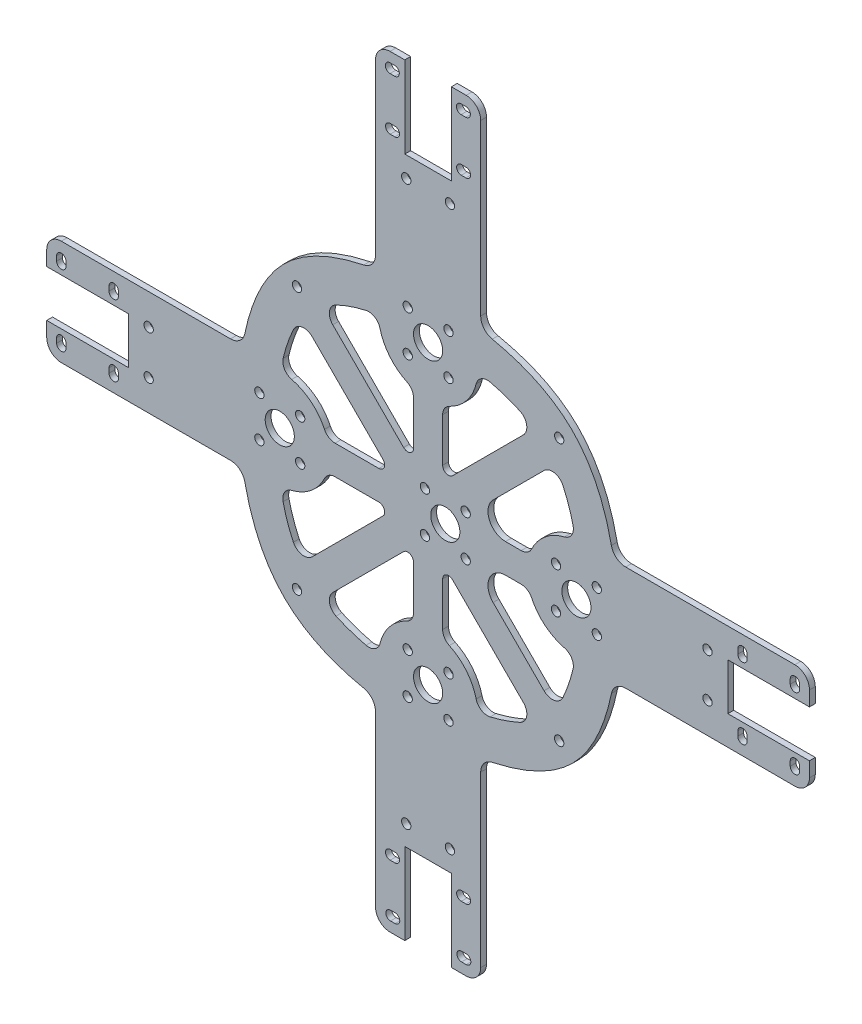
from build123d import *

# Parameters (mm, degrees)
SKETCH1_R           = 1.6
SKETCH1_R_2         = 1.599999999
SKETCH1_R_3         = 1.600000002
SKETCH1_R_4         = 1.600000003
BOSS_EXTRUDE1_DEPTH = 2
SKETCH5_R           = 5
CUT_EXTRUDE1_DEPTH  = 2
SKETCH7_R           = 1.6
CUT_EXTRUDE2_DEPTH  = 2
CUT_EXTRUDE9_DEPTH  = 2
SKETCH10_R          = 1.599999998
SKETCH10_R_2        = 1.6
CUT_EXTRUDE10_DEPTH = 2


with BuildPart() as part:
    # Sketch1 → Boss-Extrude1 (new body)
    with BuildSketch(Plane.XY.offset(157.173262417)):
        with BuildLine():
            Line((6.799091356, -38.814036397), (6.799091356, 19.286276854))
            ThreePointArc((6.799091356, 19.286276854), (5.670788043, 22.450129689), (2.795105451, 24.18606827))
            add(Edge.make_bspline(
                [(-38.04772835, 65.059119821), (-35.801922327, 54.275844913), (-27.373024283, 34.867662181), (-8.005693396, 26.381620483), (2.795105451, 24.18606827)],
                knots=[0.799368004, 0.799368004, 0.799368004, 0.799368004, 0.875, 0.95065347, 0.95065347, 0.95065347, 0.95065347], degree=3))
            ThreePointArc((-38.04772835, 65.059119821), (-39.788119726, 67.918917036), (-42.942694753, 69.039657262))
            Line((-42.942694753, 69.039657262), (-42.948724748, 69.039657262))
            Line((-42.948724748, 69.039657262), (-101.054602299, 69.039657262))
            ThreePointArc((-101.054602299, 69.039657262), (-104.590136205, 70.504123356), (-106.054602299, 74.039657262))
            Line((-106.054602299, 74.039657262), (-106.054602299, 79.097651827))
            Line((-106.054602299, 79.097651827), (-78.0546023, 79.097651827))
            Line((-78.0546023, 79.097651827), (-78.0546023, 95.09765186))
            Line((-78.0546023, 95.09765186), (-106.054602299, 95.09765186))
            Line((-106.054602299, 95.09765186), (-106.054602299, 100.155646442))
            ThreePointArc((-106.054602299, 100.155646442), (-104.590136206, 103.691180348), (-101.0546023, 105.155646442))
            Line((-101.0546023, 105.155646442), (-42.953397481, 105.155646442))
            ThreePointArc((-42.953397481, 105.155646442), (-39.798044895, 106.2770191), (-38.058022756, 109.138146417))
            add(Edge.make_bspline(
                [(2.816283675, 150.012028913), (-7.973865697, 147.770011851), (-27.384909119, 139.342710765), (-35.815468738, 119.927475159), (-38.058022756, 109.138146417)],
                knots=[0.549351375, 0.549351375, 0.549351375, 0.549351375, 0.625, 0.700642098, 0.700642098, 0.700642098, 0.700642098], degree=3))
            ThreePointArc((2.816283675, 150.012028913), (5.677619532, 151.751993102), (6.799091359, 154.907467585))
            Line((6.799091359, 154.907467585), (6.799091359, 213.009340097))
            ThreePointArc((6.799091359, 213.009340097), (8.263557453, 216.544874003), (11.799091359, 218.009340097))
            Line((11.799091359, 218.009340097), (16.857085923, 218.009340097))
            Line((16.857085923, 218.009340097), (16.857085923, 190.009340098))
            Line((16.857085923, 190.009340098), (32.857085957, 190.009340098))
            Line((32.857085957, 190.009340098), (32.857085957, 218.009340096))
            Line((32.857085957, 218.009340096), (37.915080539, 218.009340096))
            ThreePointArc((37.915080539, 218.009340096), (41.450614444, 216.544874002), (42.915080538, 213.009340096))
            Line((42.915080538, 213.009340096), (42.915080538, 154.909026846))
            Line((42.915080538, 154.909026846), (42.915080538, 154.905301106))
            ThreePointArc((42.915080538, 154.905301106), (44.03648226, 151.749912795), (46.897670695, 150.009907638))
            add(Edge.make_bspline(
                [(87.768156571, 109.138684972), (85.526226985, 119.930968468), (77.10336574, 139.339428214), (57.688773215, 147.767192319), (46.897670695, 150.009907638)],
                knots=[0.299339526, 0.299339526, 0.299339526, 0.299339526, 0.375, 0.450650992, 0.450650992, 0.450650992, 0.450650992], degree=3))
            ThreePointArc((87.768156571, 109.138684972), (89.508077273, 106.277192658), (92.663643207, 105.155646426))
            Line((92.663643207, 105.155646426), (150.768774191, 105.155646426))
            ThreePointArc((150.768774191, 105.155646426), (154.304308097, 103.691180332), (155.768774191, 100.155646426))
            Line((155.768774191, 100.155646426), (155.768774191, 95.097651862))
            Line((155.768774191, 95.097651862), (127.768774193, 95.097651862))
            Line((127.768774193, 95.097651862), (127.768774193, 79.097651829))
            Line((127.768774193, 79.097651829), (155.768774192, 79.097651829))
            Line((155.768774192, 79.097651829), (155.768774192, 74.039657246))
            ThreePointArc((155.768774192, 74.039657246), (154.304308098, 70.504123341), (150.768774193, 69.039657247))
            Line((150.768774193, 69.039657247), (92.703908608, 69.125744836))
            ThreePointArc((92.703908608, 69.125744836), (89.540785873, 68.004087134), (87.799431714, 65.135089551))
            add(Edge.make_bspline(
                [(46.865804198, 24.180503464), (57.642070723, 26.49346369), (77.144065689, 34.842133488), (85.566398269, 54.300964474), (87.799431714, 65.135089551)],
                knots=[0.04934653, 0.04934653, 0.04934653, 0.04934653, 0.125, 0.200865999, 0.200865999, 0.200865999, 0.200865999], degree=3))
            ThreePointArc((46.865804198, 24.180503464), (44.02622584, 22.434580272), (42.915080536, 19.291841156))
            Line((42.915080536, 19.291841156), (42.915080536, -38.814036396))
            ThreePointArc((42.915080536, -38.814036396), (41.450614442, -42.349570302), (37.915080536, -43.814036396))
            Line((37.915080536, -43.814036396), (32.857085971, -43.814036396))
            Line((32.857085971, -43.814036396), (32.857085971, -15.814036397))
            Line((32.857085971, -15.814036397), (16.857085938, -15.814036397))
            Line((16.857085938, -15.814036397), (16.857085938, -43.814036396))
            Line((16.857085938, -43.814036396), (11.799091355, -43.814036396))
            ThreePointArc((11.799091355, -43.814036396), (8.26355745, -42.349570302), (6.799091356, -38.814036397))
        make_face()
        with Locations((17.357085946, -8.814036393)):
            Circle(SKETCH1_R, mode=Mode.SUBTRACT)
        with Locations((32.357085946, -8.814036393)):
            Circle(SKETCH1_R, mode=Mode.SUBTRACT)
        with Locations((-71.054602297, 94.597651852)):
            Circle(SKETCH1_R_2, mode=Mode.SUBTRACT)
        with Locations((-71.054602297, 79.597651852)):
            Circle(SKETCH1_R_2, mode=Mode.SUBTRACT)
        with Locations((32.357085949, 183.009340095)):
            Circle(SKETCH1_R_3, mode=Mode.SUBTRACT)
        with Locations((17.357085949, 183.009340095)):
            Circle(SKETCH1_R_3, mode=Mode.SUBTRACT)
        with Locations((120.768774191, 79.597651849)):
            Circle(SKETCH1_R_4, mode=Mode.SUBTRACT)
        with Locations((120.768774191, 94.597651849)):
            Circle(SKETCH1_R_4, mode=Mode.SUBTRACT)
        with BuildLine():
            Line((11.857085946, -19.214036396), (13.457085935, -19.214036396))
            ThreePointArc((13.457085935, -19.214036396), (15.057085934, -20.814036397), (13.457085933, -22.414036396))
            Line((13.457085933, -22.414036396), (11.857085946, -22.414036396))
            ThreePointArc((11.857085946, -22.414036396), (10.257085946, -20.814036396), (11.857085946, -19.214036396))
        make_face(mode=Mode.SUBTRACT)
        with BuildLine():
            Line((37.857085947, -19.214036397), (36.257085947, -19.214036397))
            ThreePointArc((36.257085947, -19.214036397), (34.657085947, -20.814036397), (36.257085947, -22.414036397))
            Line((36.257085947, -22.414036397), (37.857085947, -22.414036397))
            ThreePointArc((37.857085947, -22.414036397), (39.457085947, -20.814036397), (37.857085947, -19.214036397))
        make_face(mode=Mode.SUBTRACT)
        with BuildLine():
            Line((37.938189461, -40.414036397), (36.338189461, -40.414036397))
            ThreePointArc((36.338189461, -40.414036397), (34.738189461, -38.814036397), (36.338189461, -37.214036397))
            Line((36.338189461, -37.214036397), (37.938189461, -37.214036397))
            ThreePointArc((37.938189461, -37.214036397), (39.538189461, -38.814036397), (37.938189461, -40.414036397))
        make_face(mode=Mode.SUBTRACT)
        with BuildLine():
            Line((13.538189461, -40.414036397), (11.938189461, -40.414036397))
            ThreePointArc((11.938189461, -40.414036397), (10.338189461, -38.814036397), (11.938189461, -37.214036397))
            Line((11.938189461, -37.214036397), (13.538189461, -37.214036397))
            ThreePointArc((13.538189461, -37.214036397), (15.138189461, -38.814036397), (13.538189461, -40.414036397))
        make_face(mode=Mode.SUBTRACT)
        with BuildLine():
            Line((-81.454602299, 100.097651852), (-81.454602299, 98.497651863))
            ThreePointArc((-81.454602299, 98.497651863), (-83.0546023, 96.897651864), (-84.654602299, 98.497651865))
            Line((-84.654602299, 98.497651865), (-84.654602299, 100.097651852))
            ThreePointArc((-84.654602299, 100.097651852), (-83.054602299, 101.697651852), (-81.454602299, 100.097651852))
        make_face(mode=Mode.SUBTRACT)
        with BuildLine():
            Line((-81.4546023, 74.097651851), (-81.4546023, 75.697651851))
            ThreePointArc((-81.4546023, 75.697651851), (-83.0546023, 77.297651851), (-84.6546023, 75.697651851))
            Line((-84.6546023, 75.697651851), (-84.6546023, 74.097651851))
            ThreePointArc((-84.6546023, 74.097651851), (-83.0546023, 72.497651851), (-81.4546023, 74.097651851))
        make_face(mode=Mode.SUBTRACT)
        with BuildLine():
            Line((-102.6546023, 74.016548336), (-102.6546023, 75.616548336))
            ThreePointArc((-102.6546023, 75.616548336), (-101.0546023, 77.216548336), (-99.4546023, 75.616548336))
            Line((-99.4546023, 75.616548336), (-99.4546023, 74.016548336))
            ThreePointArc((-99.4546023, 74.016548336), (-101.0546023, 72.416548336), (-102.6546023, 74.016548336))
        make_face(mode=Mode.SUBTRACT)
        with BuildLine():
            Line((-102.6546023, 98.416548336), (-102.6546023, 100.016548336))
            ThreePointArc((-102.6546023, 100.016548336), (-101.0546023, 101.616548336), (-99.4546023, 100.016548336))
            Line((-99.4546023, 100.016548336), (-99.4546023, 98.416548336))
            ThreePointArc((-99.4546023, 98.416548336), (-101.0546023, 96.816548336), (-102.6546023, 98.416548336))
        make_face(mode=Mode.SUBTRACT)
        with BuildLine():
            Line((37.857085949, 193.409340097), (36.257085959, 193.409340097))
            ThreePointArc((36.257085959, 193.409340097), (34.65708596, 195.009340098), (36.257085961, 196.609340097))
            Line((36.257085961, 196.609340097), (37.857085949, 196.609340097))
            ThreePointArc((37.857085949, 196.609340097), (39.457085949, 195.009340097), (37.857085949, 193.409340097))
        make_face(mode=Mode.SUBTRACT)
        with BuildLine():
            Line((11.857085947, 193.409340098), (13.457085947, 193.409340098))
            ThreePointArc((13.457085947, 193.409340098), (15.057085947, 195.009340098), (13.457085947, 196.609340098))
            Line((13.457085947, 196.609340098), (11.857085947, 196.609340098))
            ThreePointArc((11.857085947, 196.609340098), (10.257085947, 195.009340098), (11.857085947, 193.409340098))
        make_face(mode=Mode.SUBTRACT)
        with BuildLine():
            Line((11.775982433, 214.609340098), (13.375982433, 214.609340098))
            ThreePointArc((13.375982433, 214.609340098), (14.975982433, 213.009340098), (13.375982433, 211.409340098))
            Line((13.375982433, 211.409340098), (11.775982433, 211.409340098))
            ThreePointArc((11.775982433, 211.409340098), (10.175982433, 213.009340098), (11.775982433, 214.609340098))
        make_face(mode=Mode.SUBTRACT)
        with BuildLine():
            Line((36.175982433, 214.609340098), (37.775982433, 214.609340098))
            ThreePointArc((37.775982433, 214.609340098), (39.375982433, 213.009340098), (37.775982433, 211.409340098))
            Line((37.775982433, 211.409340098), (36.175982433, 211.409340098))
            ThreePointArc((36.175982433, 211.409340098), (34.575982433, 213.009340098), (36.175982433, 214.609340098))
        make_face(mode=Mode.SUBTRACT)
        with BuildLine():
            Line((131.168774193, 74.097651849), (131.168774193, 75.697651839))
            ThreePointArc((131.168774193, 75.697651839), (132.768774195, 77.297651838), (134.368774193, 75.697651837))
            Line((134.368774193, 75.697651837), (134.368774193, 74.097651849))
            ThreePointArc((134.368774193, 74.097651849), (132.768774193, 72.497651849), (131.168774193, 74.097651849))
        make_face(mode=Mode.SUBTRACT)
        with BuildLine():
            Line((131.168774195, 100.097651851), (131.168774195, 98.497651851))
            ThreePointArc((131.168774195, 98.497651851), (132.768774195, 96.897651851), (134.368774195, 98.497651851))
            Line((134.368774195, 98.497651851), (134.368774195, 100.097651851))
            ThreePointArc((134.368774195, 100.097651851), (132.768774195, 101.697651851), (131.168774195, 100.097651851))
        make_face(mode=Mode.SUBTRACT)
        with BuildLine():
            Line((152.368774195, 100.178755365), (152.368774195, 98.578755365))
            ThreePointArc((152.368774195, 98.578755365), (150.768774195, 96.978755365), (149.168774195, 98.578755365))
            Line((149.168774195, 98.578755365), (149.168774195, 100.178755365))
            ThreePointArc((149.168774195, 100.178755365), (150.768774195, 101.778755365), (152.368774195, 100.178755365))
        make_face(mode=Mode.SUBTRACT)
        with BuildLine():
            Line((152.368774195, 75.778755365), (152.368774195, 74.178755365))
            ThreePointArc((152.368774195, 74.178755365), (150.768774195, 72.578755365), (149.168774195, 74.178755365))
            Line((149.168774195, 74.178755365), (149.168774195, 75.778755365))
            ThreePointArc((149.168774195, 75.778755365), (150.768774195, 77.378755365), (152.368774195, 75.778755365))
        make_face(mode=Mode.SUBTRACT)
    extrude(amount=BOSS_EXTRUDE1_DEPTH)

    # Sketch5 → Cut-Extrude1 (cut)
    with BuildSketch(Plane.XY.offset(159.173262417)):
        with Locations((30.768774191, 87.097651852)):
            Circle(SKETCH5_R)
        with Locations((75.768774191, 87.097651852)):
            Circle(SKETCH5_R)
        with Locations((-26.0546023, 87.097651852)):
            Circle(SKETCH5_R)
        with Locations((24.857085946, 36.185963607)):
            Circle(SKETCH5_R)
        with Locations((24.857085946, 138.009340097)):
            Circle(SKETCH5_R)
    extrude(amount=-CUT_EXTRUDE1_DEPTH, mode=Mode.SUBTRACT)

    # Sketch7 → Cut-Extrude2 (cut)
    with BuildSketch(Plane.XY.offset(159.173262417)):
        with Locations((-20.142914054, 132.097651852)):
            Circle(SKETCH7_R)
        with Locations((69.857085946, 132.097651852)):
            Circle(SKETCH7_R)
        with Locations((-20.142914054, 42.097651852)):
            Circle(SKETCH7_R)
        with Locations((69.857085946, 42.097651852)):
            Circle(SKETCH7_R)
    extrude(amount=-CUT_EXTRUDE2_DEPTH, mode=Mode.SUBTRACT)

    # Sketch9 → Cut-Extrude9 (cut)
    with BuildSketch(Plane.XY.offset(159.173262417)):
        with BuildLine():
            Line((-7.869007222, 126.894812831), (16.442872381, 102.582933227))
            ThreePointArc((16.442872381, 102.582933227), (18.622452809, 102.149387725), (19.857085944, 103.99714679))
            Line((19.857085944, 103.99714679), (19.857085944, 119.035674139))
            ThreePointArc((19.857085944, 119.035674139), (19.237702963, 121.173764074), (17.571371659, 122.64970575))
            ThreePointArc((17.571371659, 122.64970575), (11.694515597, 127.250774127), (8.354859625, 133.925649809))
            ThreePointArc((8.354859625, 133.925649809), (6.554598547, 136.379852783), (3.548496184, 136.856718349))
            ThreePointArc((3.548496184, 136.856718349), (-1.701622597, 135.389204341), (-6.752512799, 133.338386761))
            ThreePointArc((-6.752512799, 133.338386761), (-8.981852492, 130.406154235), (-7.869007222, 126.894812831))
        make_face()
        with BuildLine():
            Line((-14.940075038, 119.823745023), (9.371804575, 95.511865409))
            ThreePointArc((9.371804575, 95.511865409), (9.805350078, 93.332284982), (7.957591013, 92.097651847))
            Line((7.957591013, 92.097651847), (-7.080936337, 92.097651847))
            ThreePointArc((-7.080936337, 92.097651847), (-9.219026273, 92.717034828), (-10.694967949, 94.383366134))
            ThreePointArc((-10.694967949, 94.383366134), (-15.296036327, 100.260222201), (-21.970912014, 103.599878175))
            ThreePointArc((-21.970912014, 103.599878175), (-24.425114988, 105.400139252), (-24.901980554, 108.406241615))
            ThreePointArc((-24.901980554, 108.406241615), (-23.390630893, 113.641388235), (-21.383648969, 118.707250599))
            ThreePointArc((-21.383648969, 118.707250599), (-18.451416443, 120.936590293), (-14.940075038, 119.823745023))
        make_face()
        with BuildLine():
            Line((19.857085945, 55.159629565), (19.857085945, 70.198156916))
            ThreePointArc((19.857085945, 70.198156916), (18.622452809, 72.045915981), (16.442872382, 71.612370478))
            Line((16.442872382, 71.612370478), (-7.869007227, 47.30049087))
            ThreePointArc((-7.869007227, 47.30049087), (-8.981852496, 43.789149465), (-6.752512803, 40.856916939))
            ThreePointArc((-6.752512803, 40.856916939), (-1.686650438, 38.849935015), (3.548496184, 37.338585353))
            ThreePointArc((3.548496184, 37.338585353), (6.554598546, 37.81545092), (8.354859623, 40.269653894))
            ThreePointArc((8.354859623, 40.269653894), (11.694515596, 46.944529577), (17.571371659, 51.545597954))
            ThreePointArc((17.571371659, 51.545597954), (19.237702964, 53.02153963), (19.857085945, 55.159629565))
        make_face()
        with BuildLine():
            Line((29.857085944, 119.035674136), (29.857085944, 103.997146778))
            ThreePointArc((29.857085944, 103.997146778), (31.091719079, 102.149387713), (33.271299507, 102.582933216))
            Line((33.271299507, 102.582933216), (57.583179124, 126.894812833))
            ThreePointArc((57.583179124, 126.894812833), (58.696024393, 130.406154237), (56.4666847, 133.338386763))
            ThreePointArc((56.4666847, 133.338386763), (51.400822333, 135.345368689), (46.165675709, 136.856718352))
            ThreePointArc((46.165675709, 136.856718352), (43.159573346, 136.379852785), (41.359312269, 133.925649811))
            ThreePointArc((41.359312269, 133.925649811), (38.019656296, 127.250774126), (32.14280023, 122.649705748))
            ThreePointArc((32.14280023, 122.649705748), (30.476468925, 121.173764072), (29.857085944, 119.035674136))
        make_face()
        with BuildLine():
            Line((-14.940075033, 54.371558676), (9.371804581, 78.68343829))
            ThreePointArc((9.371804581, 78.68343829), (9.805350084, 80.863018717), (7.957591019, 82.097651853))
            Line((7.957591019, 82.097651853), (-7.08093634, 82.097651853))
            ThreePointArc((-7.08093634, 82.097651853), (-9.219026275, 81.478268872), (-10.694967951, 79.811937567))
            ThreePointArc((-10.694967951, 79.811937567), (-15.296036328, 73.935081503), (-21.970912012, 70.595425531))
            ThreePointArc((-21.970912012, 70.595425531), (-24.425114986, 68.795164453), (-24.901980552, 65.789062091))
            ThreePointArc((-24.901980552, 65.789062091), (-23.434466545, 60.538943305), (-21.383648964, 55.488053099))
            ThreePointArc((-21.383648964, 55.488053099), (-18.451416438, 53.258713406), (-14.940075033, 54.371558676))
        make_face()
        with BuildLine():
            Line((56.795108218, 92.097651847), (51.41343513, 92.097651847))
            ThreePointArc((51.41343513, 92.097651847), (45.870157935, 95.801551252), (47.170794443, 102.340292534))
            Line((47.170794443, 102.340292534), (64.654246928, 119.823745019))
            ThreePointArc((64.654246928, 119.823745019), (68.165588332, 120.936590288), (71.097820858, 118.707250595))
            ThreePointArc((71.097820858, 118.707250595), (73.148638436, 113.656360395), (74.616152444, 108.406241616))
            ThreePointArc((74.616152444, 108.406241616), (74.139286877, 105.400139252), (71.685083901, 103.599878174))
            ThreePointArc((71.685083901, 103.599878174), (65.010208211, 100.260222202), (60.40913983, 94.383366133))
            ThreePointArc((60.40913983, 94.383366133), (58.933198153, 92.717034828), (56.795108218, 92.097651847))
        make_face()
        with BuildLine():
            Line((47.170794443, 71.855011166), (64.654246929, 54.37155868))
            ThreePointArc((64.654246929, 54.37155868), (68.165588333, 53.25871341), (71.097820859, 55.488053103))
            ThreePointArc((71.097820859, 55.488053103), (73.104802783, 60.553915466), (74.616152444, 65.789062085))
            ThreePointArc((74.616152444, 65.789062085), (74.139286877, 68.795164449), (71.685083901, 70.595425525))
            ThreePointArc((71.685083901, 70.595425525), (65.010208211, 73.935081498), (60.40913983, 79.811937567))
            ThreePointArc((60.40913983, 79.811937567), (58.933198153, 81.478268872), (56.795108218, 82.097651853))
            Line((56.795108218, 82.097651853), (51.41343513, 82.097651853))
            ThreePointArc((51.41343513, 82.097651853), (45.870157935, 78.393752447), (47.170794443, 71.855011166))
        make_face()
        with BuildLine():
            Line((29.85708595, 70.19815691), (29.85708595, 55.159629563))
            ThreePointArc((29.85708595, 55.159629563), (30.476468931, 53.021539629), (32.142800235, 51.545597952))
            ThreePointArc((32.142800235, 51.545597952), (38.019656296, 46.944529576), (41.359312267, 40.269653894))
            ThreePointArc((41.359312267, 40.269653894), (43.159573345, 37.81545092), (46.165675708, 37.338585354))
            ThreePointArc((46.165675708, 37.338585354), (51.400822327, 38.849935016), (56.466684691, 40.85691694))
            ThreePointArc((56.466684691, 40.85691694), (58.696024384, 43.789149466), (57.583179115, 47.300490871))
            Line((57.583179115, 47.300490871), (33.271299513, 71.612370473))
            ThreePointArc((33.271299513, 71.612370473), (31.091719086, 72.045915975), (29.85708595, 70.19815691))
        make_face()
    extrude(amount=-CUT_EXTRUDE9_DEPTH, mode=Mode.SUBTRACT)

    # Sketch10 → Cut-Extrude10 (cut)
    with BuildSketch(Plane.XY.offset(159.173262417)):
        with Locations((17.857085948, 145.009340097)):
            Circle(SKETCH10_R)
        with Locations((31.857085946, 145.009340097)):
            Circle(SKETCH10_R_2)
        with Locations((17.857085946, 131.009340097)):
            Circle(SKETCH10_R_2)
        with Locations((31.857085948, 131.009340097)):
            Circle(SKETCH10_R)
        with Locations((68.768774191, 80.097651852)):
            Circle(SKETCH10_R_2)
        with Locations((82.768774191, 94.097651852)):
            Circle(SKETCH10_R_2)
        with Locations((82.768774191, 80.097651852)):
            Circle(SKETCH10_R_2)
        with Locations((68.768774191, 94.097651852)):
            Circle(SKETCH10_R_2)
        with Locations((-33.0546023, 94.097651852)):
            Circle(SKETCH10_R_2)
        with Locations((-19.0546023, 80.097651852)):
            Circle(SKETCH10_R_2)
        with Locations((-33.0546023, 80.097651852)):
            Circle(SKETCH10_R_2)
        with Locations((-19.0546023, 94.097651852)):
            Circle(SKETCH10_R_2)
        with Locations((31.857085946, 29.185963607)):
            Circle(SKETCH10_R_2)
        with Locations((31.857085946, 43.185963607)):
            Circle(SKETCH10_R_2)
        with Locations((17.857085946, 43.185963607)):
            Circle(SKETCH10_R_2)
        with Locations((17.857085946, 29.185963607)):
            Circle(SKETCH10_R_2)
        with Locations((37.768774191, 80.097651852)):
            Circle(SKETCH10_R_2)
        with Locations((23.768774191, 80.097651852)):
            Circle(SKETCH10_R_2)
        with Locations((23.768774191, 94.097651852)):
            Circle(SKETCH10_R_2)
        with Locations((37.768774191, 94.097651852)):
            Circle(SKETCH10_R_2)
    extrude(amount=-CUT_EXTRUDE10_DEPTH, mode=Mode.SUBTRACT)


solid = part.part
